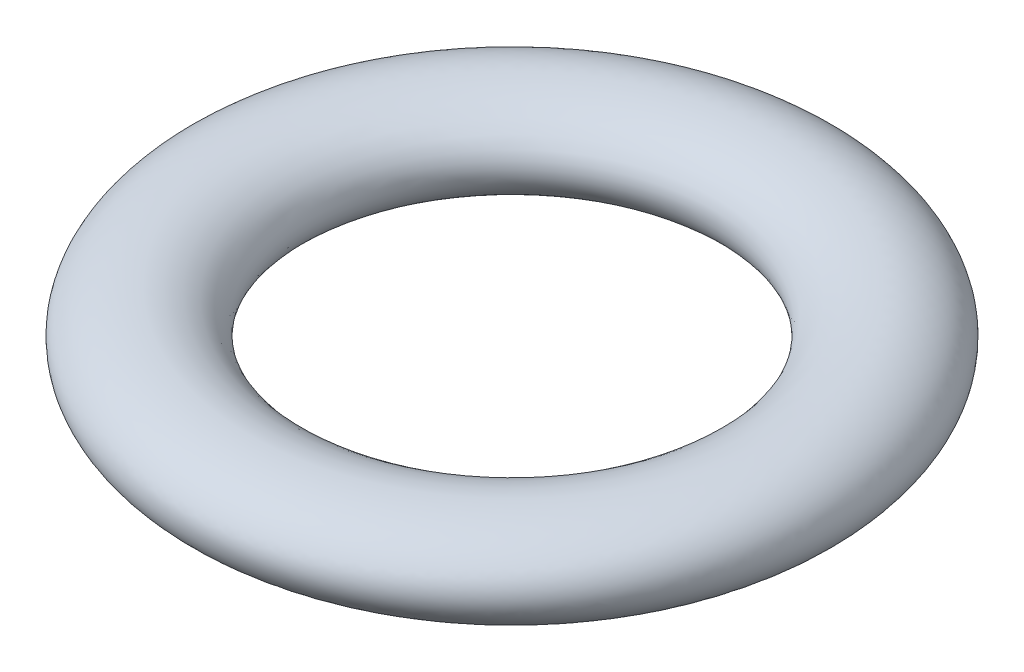
from build123d import *

# Parameters (mm, degrees)
RECONSTRUCTED_NOMINAL_AXIAL_PROFILE_RX = 2.994791667
RECONSTRUCTED_NOMINAL_AXIAL_PROFILE_RY = 2


with BuildPart() as part:
    # Reconstructed nominal axial profile → Native revolved geometry (revolve)
    with BuildSketch(Plane.XY):
        with Locations((12, 0)):
            Ellipse(RECONSTRUCTED_NOMINAL_AXIAL_PROFILE_RX, RECONSTRUCTED_NOMINAL_AXIAL_PROFILE_RY)
    revolve(axis=Axis((0, -500, 0), (0, 1, 0)))


solid = part.part
